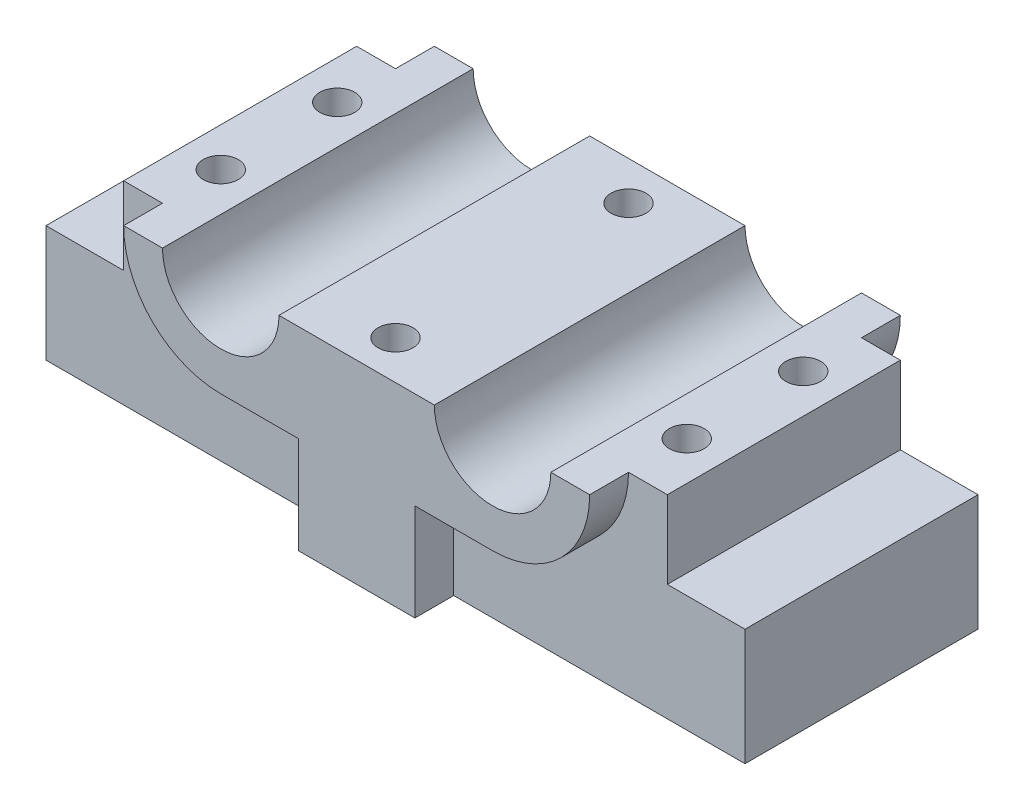
from build123d import *

# Parameters (mm, degrees)
SKETCH3_W             = 90
SKETCH3_H             = 25
BOSS_EXTRUDE1_DEPTH   = 20
SKETCH4_W             = 10
SKETCH4_H             = 10
CUT_EXTRUDE1_DEPTH    = 40
CUT_EXTRUDE2_DEPTH    = 5
CUT_EXTRUDE3_DEPTH    = 62.491869381
F_1_0MM_DOWEL_HOLE1_D = 4.5
LPATTERN1_COUNT       = 2
LPATTERN1_PITCH       = 60
LPATTERN1_COUNT_DIR2  = 2
LPATTERN1_PITCH_DIR2  = 15
F_1_0MM_DOWEL_HOLE2_D = 4.5


with BuildPart() as part:
    # Sketch3 → Boss-Extrude1 (new, symmetric)
    with BuildSketch(Plane.XY):
        Rectangle(SKETCH3_W, SKETCH3_H)
    extrude(amount=BOSS_EXTRUDE1_DEPTH, both=True)

    # Sketch4 → Cut-Extrude1 (cut)
    with BuildSketch(Plane.XY.offset(20)):
        with Locations((-40, 7.5)):
            Rectangle(SKETCH4_W, SKETCH4_H)
        with Locations((40, 7.5)):
            Rectangle(SKETCH4_W, SKETCH4_H)
    extrude(amount=-CUT_EXTRUDE1_DEPTH, mode=Mode.SUBTRACT)

    # Sketch5 → Cut-Extrude2 (cut)
    with BuildSketch(Plane.XY.offset(20)):
        with BuildLine():
            ThreePointArc((-17.5, 0), (-26.338834765, 3.661165235), (-30, 12.5))
            Line((-30, 12.5), (-35, 12.5))
            Line((-35, 12.5), (-35, 2.5))
            Line((-35, 2.5), (-45, 2.5))
            Line((-45, 2.5), (-45, -12.5))
            Line((-45, -12.5), (-7.5, -12.5))
            Line((-7.5, -12.5), (-7.5, 0))
            Line((-7.5, 0), (-17.5, 0))
        make_face()
        with BuildLine():
            ThreePointArc((30, 12.5), (26.338834765, 3.661165235), (17.5, 0))
            Line((17.5, 0), (7.5, 0))
            Line((7.5, 0), (7.5, -12.5))
            Line((7.5, -12.5), (45, -12.5))
            Line((45, -12.5), (45, 2.5))
            Line((45, 2.5), (35, 2.5))
            Line((35, 2.5), (35, 12.5))
            Line((35, 12.5), (30, 12.5))
        make_face()
    cut_extrude2 = extrude(amount=-CUT_EXTRUDE2_DEPTH, mode=Mode.SUBTRACT)

    # Mirror2: Cut-Extrude2 across plane
    add(cut_extrude2.mirror(Plane(origin=(0, 0, 0), x_dir=(1, 0, 0), z_dir=(0, 0, -1))), mode=Mode.SUBTRACT)

    # Sketch7 → Cut-Extrude3 (cut, through all)
    with BuildSketch(Plane.XY.offset(20)):
        with BuildLine():
            Line((-25, 12.5), (-10, 12.5))
            ThreePointArc((-10, 12.5), (-17.5, 5), (-25, 12.5))
        make_face()
        with BuildLine():
            Line((10, 12.5), (25, 12.5))
            ThreePointArc((25, 12.5), (17.5, 5), (10, 12.5))
        make_face()
    extrude(amount=-CUT_EXTRUDE3_DEPTH, mode=Mode.SUBTRACT)

    # Ø1.0mm Dowel Hole1 (through all)
    with Locations(Plane(origin=(0, 12.5, 0), x_dir=(1, 0, 0), z_dir=(0, 1, 0))):
        with Locations((30, -7.5)):
            f_1_0mm_dowel_hole1 = Hole(F_1_0MM_DOWEL_HOLE1_D / 2)

    # LPattern1: 1.0mm Dowel Hole1 2 × 2
    with Locations(*[(-i * LPATTERN1_PITCH, 0, -j * LPATTERN1_PITCH_DIR2) for i in range(LPATTERN1_COUNT) for j in range(LPATTERN1_COUNT_DIR2) if (i, j) != (0, 0)]):
        add(f_1_0mm_dowel_hole1, mode=Mode.SUBTRACT)

    # Ø1.0mm Dowel Hole2 (through all)
    with Locations(Plane(origin=(0, 12.5, 0), x_dir=(1, 0, 0), z_dir=(0, 1, 0))):
        with Locations((0, -15)):
            f_1_0mm_dowel_hole2 = Hole(F_1_0MM_DOWEL_HOLE2_D / 2)

    # Mirror3: Ø1.0mm Dowel Hole2 across plane
    add(f_1_0mm_dowel_hole2.mirror(Plane.XY), mode=Mode.SUBTRACT)


solid = part.part
